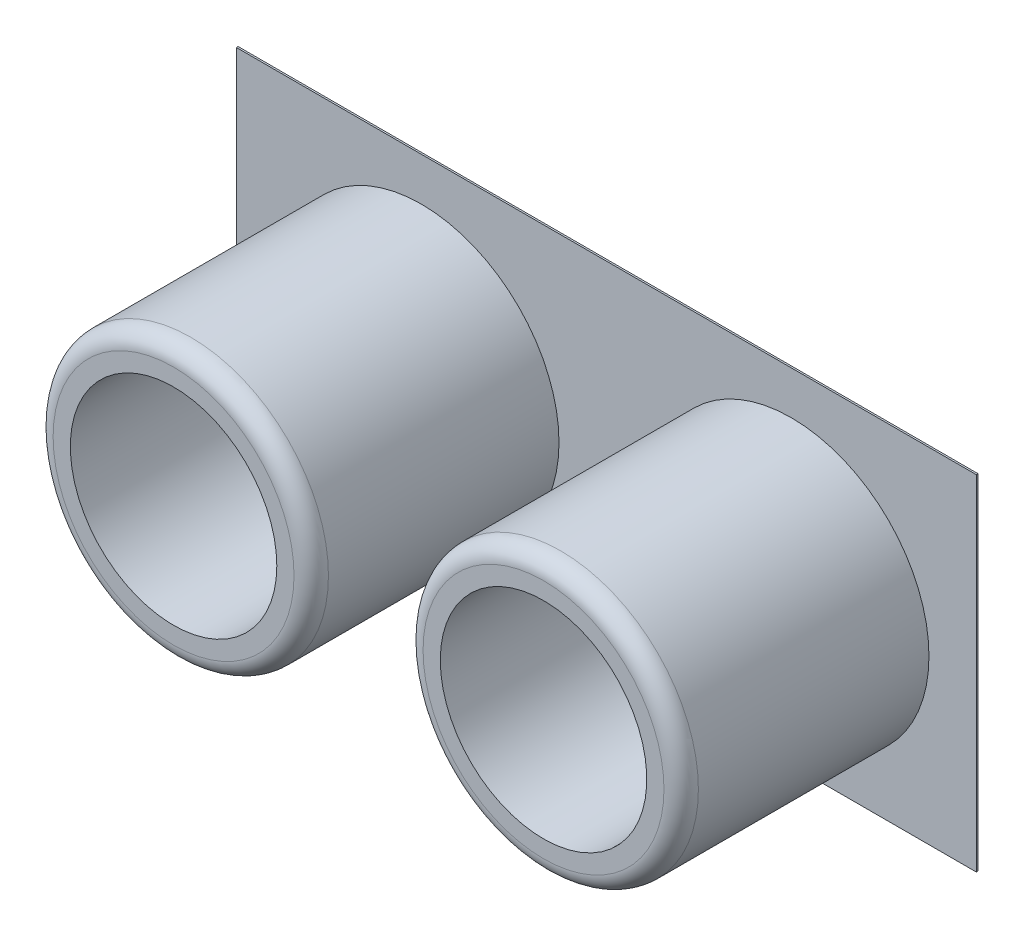
from build123d import *

# Parameters (mm, degrees)
SKETCH1_W           = 43
SKETCH1_H           = 20
BOSS_EXTRUDE1_DEPTH = 0.1
SKETCH3_R           = 8
BOSS_EXTRUDE2_DEPTH = 14.4
FILLET1_R           = 1
SKETCH5_R           = 6
CUT_EXTRUDE1_DEPTH  = 10


with BuildPart() as part:
    # Sketch1 → Boss-Extrude1 (new body)
    with BuildSketch(Plane.XY):
        with Locations((0, 0.508181818)):
            Rectangle(SKETCH1_W, SKETCH1_H)
    extrude(amount=BOSS_EXTRUDE1_DEPTH)

    # Sketch3 → Boss-Extrude2 (add)
    with BuildSketch(Plane.XY.offset(0.1)):
        with Locations((-10.75, 0)):
            Circle(SKETCH3_R)
        with Locations(Location((10.75, 0, 0), (0, 0, 180))):
            Circle(SKETCH3_R)
    extrude(amount=BOSS_EXTRUDE2_DEPTH)

    # Fillet1
    fillet1_edges = [part.edges().sort_by_distance(p)[0] for p in [
        (-18.75, 0, 14.5),
        (18.75, 0, 14.5),
    ]]
    fillet(fillet1_edges, radius=FILLET1_R)

    # Sketch5 → Cut-Extrude1 (cut)
    with BuildSketch(Plane.XY.offset(14.5)):
        with Locations((-10.75, 0)):
            Circle(SKETCH5_R)
        with Locations(Location((10.75, 0, 0), (0, 0, 180))):
            Circle(SKETCH5_R)
    extrude(amount=-CUT_EXTRUDE1_DEPTH, mode=Mode.SUBTRACT)


solid = part.part
